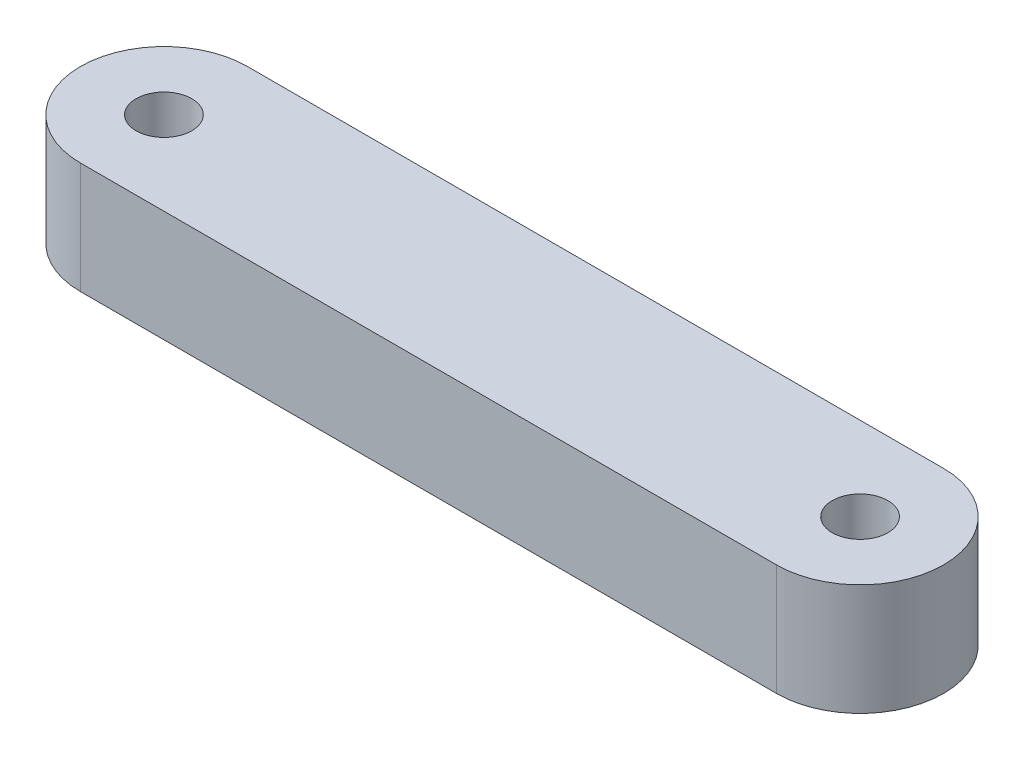
from build123d import *

# Parameters (mm, degrees)
SKETCH1_R           = 1
BOSS_EXTRUDE1_DEPTH = 4


with BuildPart() as part:
    # Sketch1 → Boss-Extrude1 (new body)
    with BuildSketch(Plane(origin=(0, 0, 0), x_dir=(1, 0, 0), z_dir=(0, 1, 0))):
        with BuildLine():
            Line((0, 3), (25, 3))
            ThreePointArc((25, 3), (28, 0), (25, -3))
            Line((25, -3), (0, -3))
            ThreePointArc((0, -3), (-3, 0), (0, 3))
        make_face()
        with Locations(Location((25, 0, 0), (0, 0, 270))):
            Circle(SKETCH1_R, mode=Mode.SUBTRACT)
        with Locations(Location((0, 0, 0), (0, 0, 270))):
            Circle(SKETCH1_R, mode=Mode.SUBTRACT)
    extrude(amount=BOSS_EXTRUDE1_DEPTH)


solid = part.part
